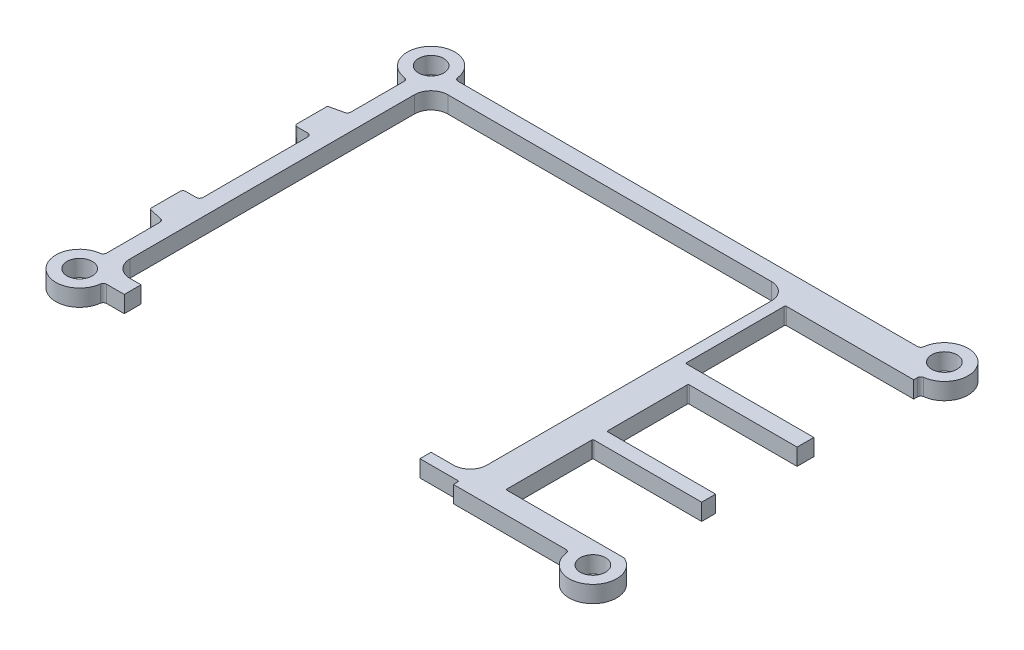
from build123d import *

# Parameters (mm, degrees)
SKETCH1_R           = 2.265
BOSS_EXTRUDE1_DEPTH = 3
SKETCH2_W           = 6.5
SKETCH2_H           = 20
CUT_EXTRUDE1_DEPTH  = 3
BOSS_EXTRUDE2_DEPTH = 3
CUT_EXTRUDE2_DEPTH  = 3
SKETCH5_W           = 3
SKETCH5_H           = 20
BOSS_EXTRUDE3_DEPTH = 3
SKETCH6_W           = 27.010134686
SKETCH6_H           = 17.9
CUT_EXTRUDE3_DEPTH  = 3
SKETCH7_W           = 19.5
SKETCH7_H           = 14.6
CUT_EXTRUDE4_DEPTH  = 3
SKETCH8_W           = 19.5
SKETCH8_H           = 15.6
CUT_EXTRUDE5_DEPTH  = 3
SKETCH9_W           = 2.019620965
SKETCH9_H           = 0.574286347
CUT_EXTRUDE6_DEPTH  = 3
SKETCH10_W          = 52
SKETCH10_H          = 3
CUT_EXTRUDE7_DEPTH  = 3
SKETCH11_W          = 7
SKETCH11_H          = 1
CUT_EXTRUDE8_DEPTH  = 3
FILLET1_R           = 0.6
FILLET2_R           = 0.2


with BuildPart() as part:
    # Sketch1 → Boss-Extrude1 (new body)
    with BuildSketch(Plane(origin=(0, 0, 0), x_dir=(1, 0, 0), z_dir=(0, 1, 0))):
        with BuildLine():
            Line((4.265, 0), (87.735, 0))
            ThreePointArc((87.735, 0), (95.015810422, 3.015810422), (92, -4.265))
            Line((92, -4.265), (92, -58.735))
            ThreePointArc((92, -58.735), (95.015810422, -66.015810422), (87.735, -63))
            Line((87.735, -63), (4.265, -63))
            ThreePointArc((4.265, -63), (-3.015810422, -66.015810422), (0, -58.735))
            Line((0, -58.735), (0, -4.265))
            ThreePointArc((0, -4.265), (-3.015810422, 3.015810422), (4.265, 0))
        make_face()
        with Locations(Location((0, 0, 0), (0, 0, 270))):
            Circle(SKETCH1_R, mode=Mode.SUBTRACT)
        with Locations(Location((92, 0, 0), (0, 0, 270))):
            Circle(SKETCH1_R, mode=Mode.SUBTRACT)
        with Locations(Location((92, -63, 0), (0, 0, 270))):
            Circle(SKETCH1_R, mode=Mode.SUBTRACT)
        with Locations(Location((0, -63, 0), (0, 0, 270))):
            Circle(SKETCH1_R, mode=Mode.SUBTRACT)
    extrude(amount=BOSS_EXTRUDE1_DEPTH)

    # Sketch2 → Cut-Extrude1 (cut)
    with BuildSketch(Plane(origin=(0, 3, 0), x_dir=(1, 0, 0), z_dir=(0, 1, 0))):
        with Locations((3.25, -31.5)):
            Rectangle(SKETCH2_W, SKETCH2_H)
    extrude(amount=-CUT_EXTRUDE1_DEPTH, mode=Mode.SUBTRACT)

    # Sketch3 → Boss-Extrude2 (add)
    with BuildSketch(Plane(origin=(0, 3, 0), x_dir=(1, 0, 0), z_dir=(0, 1, 0))):
        with BuildLine():
            Line((-2.7, -15.5), (0, -14.9))
            Line((0, -14.9), (0, -21.5))
            Line((0, -21.5), (-2.5, -21.5))
            ThreePointArc((-2.5, -21.5), (-2.853553391, -21.353553391), (-3, -21))
            Line((-3, -21), (-3, -15.8))
            ThreePointArc((-3, -15.8), (-2.912132034, -15.587867966), (-2.7, -15.5))
        make_face()
        with BuildLine():
            Line((-3, -42), (-3, -47.2))
            ThreePointArc((-3, -47.2), (-2.912132034, -47.412132034), (-2.7, -47.5))
            Line((-2.7, -47.5), (0, -48.1))
            Line((0, -48.1), (0, -41.5))
            Line((0, -41.5), (-2.5, -41.5))
            ThreePointArc((-2.5, -41.5), (-2.853553391, -41.646446609), (-3, -42))
        make_face()
    extrude(amount=-BOSS_EXTRUDE2_DEPTH)

    # Sketch4 → Cut-Extrude2 (cut)
    with BuildSketch(Plane(origin=(0, 3, 0), x_dir=(1, 0, 0), z_dir=(0, 1, 0))):
        with BuildLine():
            Line((6, -3), (64, -3))
            ThreePointArc((64, -3), (66.121320344, -3.878679656), (67, -6))
            Line((67, -6), (67, -57))
            ThreePointArc((67, -57), (66.121320344, -59.121320344), (64, -60))
            Line((64, -60), (6, -60))
            ThreePointArc((6, -60), (3.878679656, -59.121320344), (3, -57))
            Line((3, -57), (3, -6))
            ThreePointArc((3, -6), (3.878679656, -3.878679656), (6, -3))
        make_face()
    extrude(amount=-CUT_EXTRUDE2_DEPTH, mode=Mode.SUBTRACT)

    # Sketch5 → Boss-Extrude3 (add)
    with BuildSketch(Plane(origin=(0, 3, 0), x_dir=(1, 0, 0), z_dir=(0, 1, 0))):
        with Locations((1.5, -31.5)):
            Rectangle(SKETCH5_W, SKETCH5_H)
    extrude(amount=-BOSS_EXTRUDE3_DEPTH)

    # Sketch6 → Cut-Extrude3 (cut)
    with BuildSketch(Plane(origin=(0, 3, 0), x_dir=(1, 0, 0), z_dir=(0, 1, 0))):
        with Locations((82.505067343, -14.45)):
            Rectangle(SKETCH6_W, SKETCH6_H)
    extrude(amount=-CUT_EXTRUDE3_DEPTH, mode=Mode.SUBTRACT)

    # Sketch7 → Cut-Extrude4 (cut)
    with BuildSketch(Plane(origin=(0, 3, 0), x_dir=(1, 0, 0), z_dir=(0, 1, 0))):
        with Locations((82.25, -33.7)):
            Rectangle(SKETCH7_W, SKETCH7_H)
    extrude(amount=-CUT_EXTRUDE4_DEPTH, mode=Mode.SUBTRACT)

    # Sketch8 → Cut-Extrude5 (cut)
    with BuildSketch(Plane(origin=(0, 3, 0), x_dir=(1, 0, 0), z_dir=(0, 1, 0))):
        with Locations((82.25, -51.3)):
            Rectangle(SKETCH8_W, SKETCH8_H)
    extrude(amount=-CUT_EXTRUDE5_DEPTH, mode=Mode.SUBTRACT)

    # Sketch9 → Cut-Extrude6 (cut)
    with BuildSketch(Plane(origin=(0, 3, 0), x_dir=(1, 0, 0), z_dir=(0, 1, 0))):
        with Locations((93.009810483, -58.812856827)):
            Rectangle(SKETCH9_W, SKETCH9_H)
    extrude(amount=-CUT_EXTRUDE6_DEPTH, mode=Mode.SUBTRACT)

    # Sketch10 → Cut-Extrude7 (cut)
    with BuildSketch(Plane(origin=(0, 3, 0), x_dir=(1, 0, 0), z_dir=(0, 1, 0))):
        with Locations((34, -61.5)):
            Rectangle(SKETCH10_W, SKETCH10_H)
    extrude(amount=-CUT_EXTRUDE7_DEPTH, mode=Mode.SUBTRACT)

    # Sketch11 → Cut-Extrude8 (cut)
    with BuildSketch(Plane(origin=(0, 3, 0), x_dir=(1, 0, 0), z_dir=(0, 1, 0))):
        with Locations((63.5, -62.5)):
            Rectangle(SKETCH11_W, SKETCH11_H)
    extrude(amount=-CUT_EXTRUDE8_DEPTH, mode=Mode.SUBTRACT)

    # Fillet1
    fillet1_edges = [part.edges().sort_by_distance(p)[0] for p in [
        (0, 1.5, 41.5),
        (92, 1.5, 4.265),
        (0, 1.5, 21.5),
        (87.735, 1.5, 63),
        (4.265, 1.5, 63),
        (0, 1.5, 58.735),
        (0, 1.5, 4.265),
        (4.265, 1.5, 0),
        (87.735, 1.5, 0),
        (93.726332818, 1.5, 59.1),
        (0, 1.5, 14.9),
        (0, 1.5, 48.1),
    ]]
    fillet(fillet1_edges, radius=FILLET1_R)

    # Fillet2
    fillet2_edges = [part.edges().sort_by_distance(p)[0] for p in [
        (69, 1.5, 5.5),
        (69, 1.5, 23.4),
        (72.5, 1.5, 41),
        (72.5, 1.5, 26.4),
        (72.5, 1.5, 59.1),
        (72.5, 1.5, 43.5),
        (67, 1.5, 62),
    ]]
    fillet(fillet2_edges, radius=FILLET2_R)


solid = part.part
